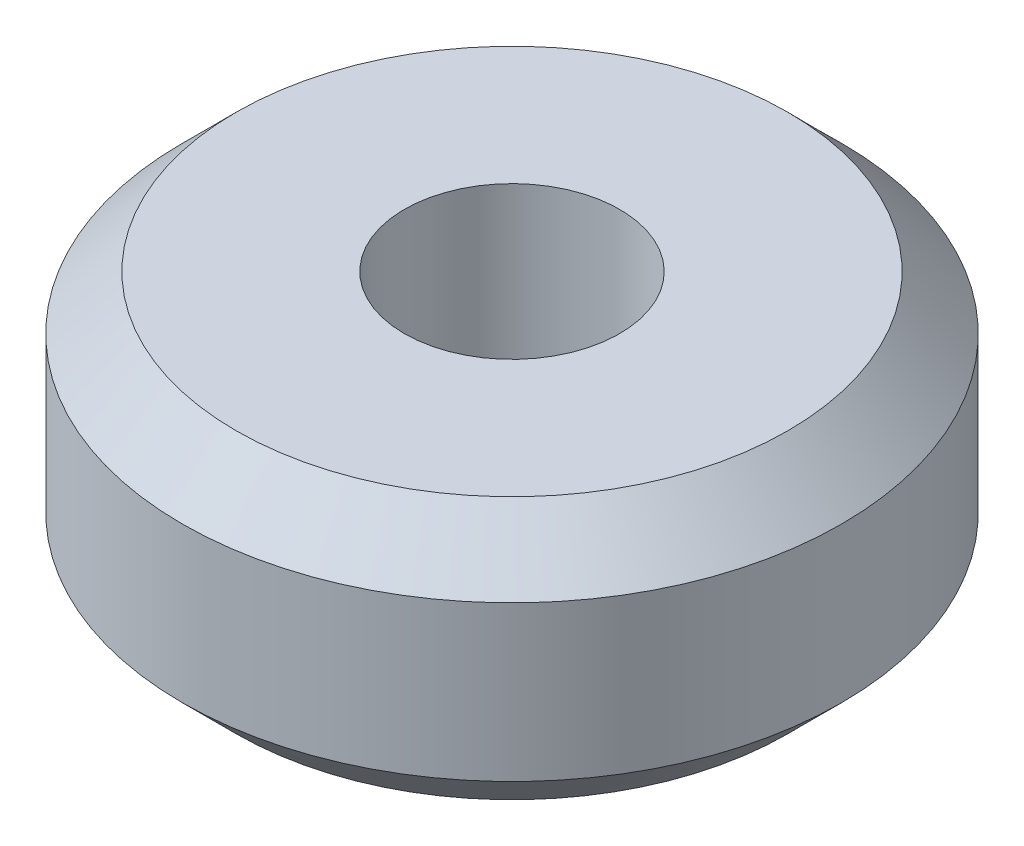
from build123d import *

# Parameters (mm, degrees)
SKETCH1_R           = 4.9
SKETCH1_R_2         = 1.6
BOSS_EXTRUDE1_DEPTH = 3.9
CHAMFER1_SIZE       = 0.8


with BuildPart() as part:
    # Sketch1 → Boss-Extrude1 (new body)
    with BuildSketch(Plane(origin=(0, 0, 0), x_dir=(1, 0, 0), z_dir=(0, 1, 0))):
        with Locations(Location((0, 0, 0), (0, 0, 270))):
            Circle(SKETCH1_R)
        with Locations(Location((0, 0, 0), (0, 0, 270))):
            Circle(SKETCH1_R_2, mode=Mode.SUBTRACT)
    extrude(amount=BOSS_EXTRUDE1_DEPTH)

    # Chamfer1
    chamfer1_edges = [part.edges().sort_by_distance(p)[0] for p in [
        (0, 0, -4.9),
        (0, 3.9, -4.9),
    ]]
    chamfer(chamfer1_edges, length=CHAMFER1_SIZE)


solid = part.part
